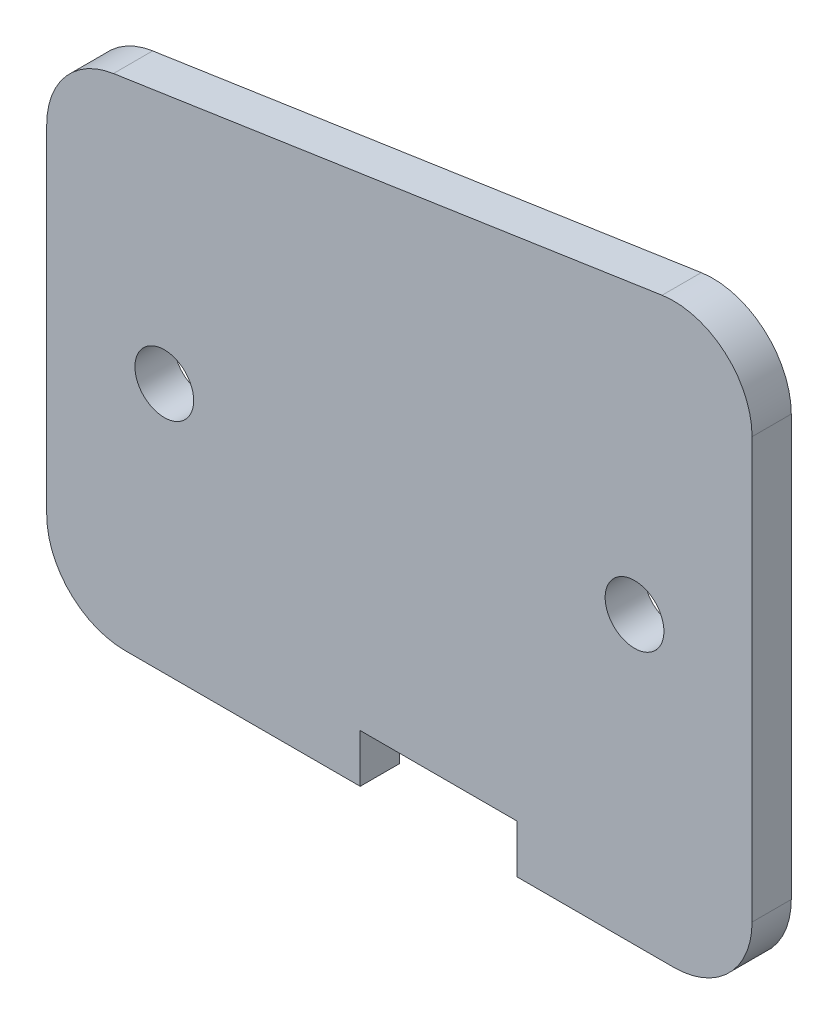
from build123d import *

# Parameters (mm, degrees)
BOSS_EXTRUDE1_DEPTH = 3.175


with BuildPart() as part:
    # Sketch1 → Boss-Extrude1 (new body)
    with BuildSketch(Plane.XY):
        with BuildLine():
            Line((-152.4, 22.70125), (-152.4, 40.64))
            Line((-152.4, 40.64), (-156.516961876, 40.022455719))
            ThreePointArc((-156.516961876, 40.022455719), (-160.386650336, 37.886442621), (-161.925, 33.742709878))
            Line((-161.925, 33.742709878), (-161.925, 6.35))
            ThreePointArc((-161.925, 6.35), (-160.065128061, 1.859871939), (-155.575, 0))
            Line((-155.575, 0), (-152.4, 0))
            Line((-152.4, 0), (-152.4, 17.93875))
            ThreePointArc((-152.4, 17.93875), (-154.78125, 20.32), (-152.4, 22.70125))
        make_face()
        with BuildLine():
            Line((-123.825, 0), (-114.3, 0))
            Line((-114.3, 0), (-114.3, 20.79625))
            ThreePointArc((-114.3, 20.79625), (-116.68125, 23.1775), (-114.3, 25.55875))
            Line((-114.3, 25.55875), (-114.3, 46.355))
            Line((-114.3, 46.355), (-152.4, 40.64))
            Line((-152.4, 40.64), (-152.4, 22.70125))
            ThreePointArc((-152.4, 22.70125), (-150.716201977, 22.003798023), (-150.01875, 20.32))
            ThreePointArc((-150.01875, 20.32), (-150.716201977, 18.636201977), (-152.4, 17.93875))
            Line((-152.4, 17.93875), (-152.4, 0))
            Line((-152.4, 0), (-136.525, 0))
            Line((-136.525, 0), (-136.525, 3.915859715))
            Line((-136.525, 3.915859715), (-123.825, 3.915859715))
            Line((-123.825, 3.915859715), (-123.825, 0))
        make_face()
        with BuildLine():
            Line((-114.3, 20.79625), (-114.3, 0))
            Line((-114.3, 0), (-111.125, 0))
            ThreePointArc((-111.125, 0), (-106.634871939, 1.859871939), (-104.775, 6.35))
            Line((-104.775, 6.35), (-104.775, 40.410209878))
            ThreePointArc((-104.775, 40.410209878), (-106.981267257, 45.221860214), (-112.066961876, 46.689955719))
            Line((-112.066961876, 46.689955719), (-114.3, 46.355))
            Line((-114.3, 46.355), (-114.3, 25.55875))
            ThreePointArc((-114.3, 25.55875), (-112.616201977, 24.861298023), (-111.91875, 23.1775))
            ThreePointArc((-111.91875, 23.1775), (-112.616201977, 21.493701977), (-114.3, 20.79625))
        make_face()
    extrude(amount=BOSS_EXTRUDE1_DEPTH)


solid = part.part
